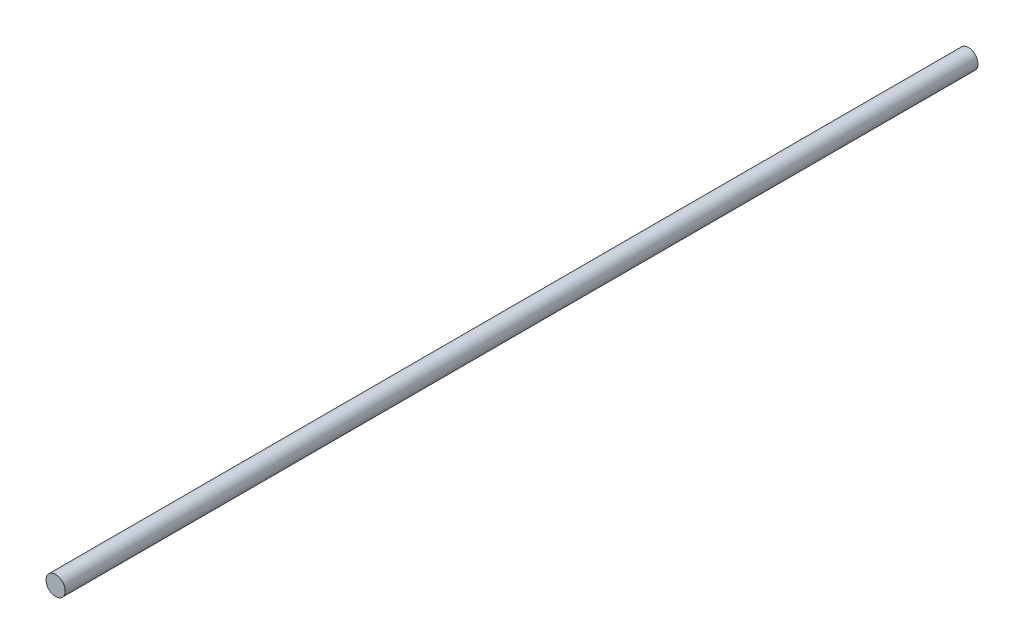
from build123d import *

# Parameters (mm, degrees)
SKETCH_1_R      = 4
EXTRUDE_1_DEPTH = 380


with BuildPart() as part:
    # Эскиз1 → Бобышка-Вытянуть1 (new body)
    with BuildSketch(Plane.XY):
        Circle(SKETCH_1_R)
    extrude(amount=EXTRUDE_1_DEPTH)


solid = part.part
